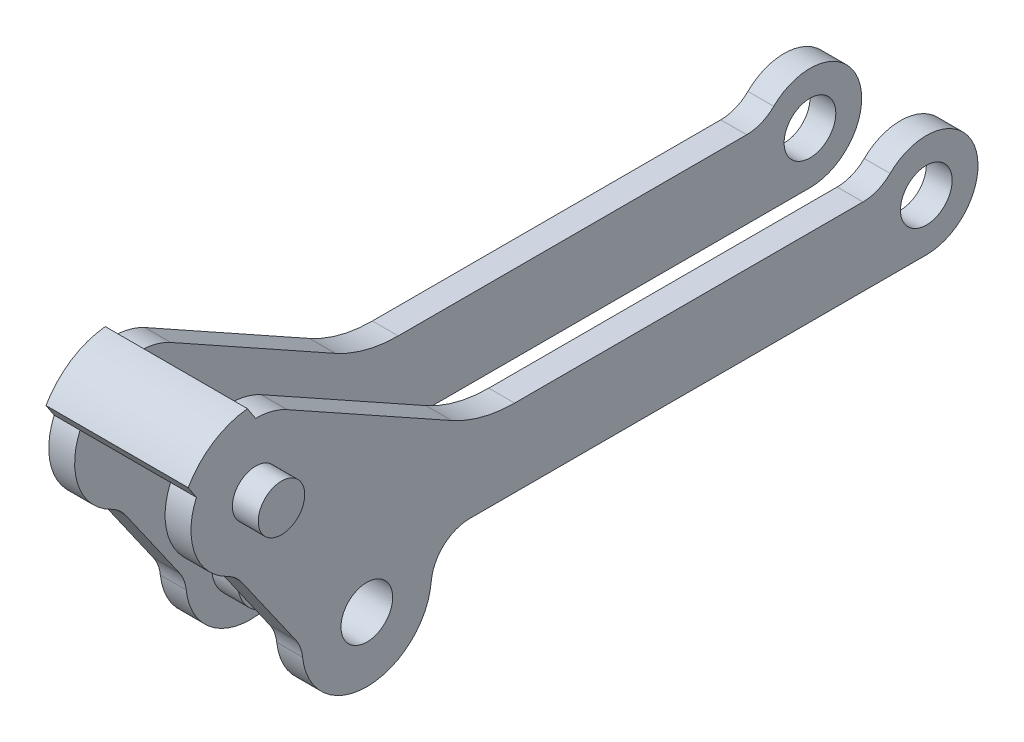
from build123d import *

# Parameters (mm, degrees)
EXTRUDE_1_DEPTH          = 2
SKETCH_1_4_R             = 3
EXTRUDE_2_DEPTH          = 2
CUT_EXTRUDE_1_DEPTH      = 51.040969284
CUT_EXTRUDE_1_DEPTH_BACK = 51.040969284
SKETCH_1_3_R             = 2
FILLET_1_R               = 3
EXTRUDE_START            = -2
SKETCH_2_R               = 2
EXTRUDE_3_DEPTH          = 2
SKETCH_2_3_R             = 1.8
EXTRUDE_4_DEPTH          = 2
EXTRUDE_6_DEPTH          = 2
EXTRUDE_START_2          = -5.5
EXTRUDE_5_DEPTH          = 5.5
FILLET_3_R               = 10


with BuildPart() as part:
    # 草图1 → 凸台-拉伸1 (new body)
    with BuildSketch(Plane(origin=(0, 0, 0), x_dir=(0, 0, -1), z_dir=(1, 0, 0))):
        with BuildLine():
            Line((40.737143614, 0), (0, 0))
            Line((0, 0), (2.48051592, -3.542543867))
            ThreePointArc((2.48051592, -3.542543867), (4.165783411, -4.487079684), (5.367176995, -6))
            Line((5.367176995, -6), (44.201245229, -6))
            ThreePointArc((44.201245229, -6), (40.737143614, -4), (40.737143614, 0))
        make_face()
        with BuildLine():
            Line((2.48051592, -3.542543867), (0, 0))
            Line((0, 0), (-2.681672007, 3.829824531))
            ThreePointArc((-2.681672007, 3.829824531), (-4.811127311, -0.102785303), (-9.234888361, -0.758786959))
            Line((-9.234888361, -0.758786959), (-4.072700434, -8.131155358))
            ThreePointArc((-4.072700434, -8.131155358), (-1.94324513, -4.198545524), (2.48051592, -3.542543867))
        make_face()
        with BuildLine():
            ThreePointArc((48.201245229, -2), (45.23652141, 1.863703305), (40.737143614, 0))
            Line((40.737143614, 0), (44.201245229, 0))
            ThreePointArc((44.201245229, 0), (45.615458792, -0.585786438), (46.201245229, -2))
            ThreePointArc((46.201245229, -2), (45.615458792, -3.414213562), (44.201245229, -4))
            Line((44.201245229, -4), (44.201245229, -6))
            ThreePointArc((44.201245229, -6), (47.029672354, -4.828427125), (48.201245229, -2))
        make_face()
        with BuildLine():
            Line((44.201245229, 0), (40.737143614, 0))
            ThreePointArc((40.737143614, 0), (40.737143614, -4), (44.201245229, -6))
            Line((44.201245229, -6), (44.201245229, -4))
            ThreePointArc((44.201245229, -4), (42.201245229, -2), (44.201245229, 0))
        make_face()
        with BuildLine():
            ThreePointArc((5.367176995, -6), (4.165783411, -4.487079684), (2.48051592, -3.542543867))
            Line((2.48051592, -3.542543867), (4.201245229, -6))
            Line((4.201245229, -6), (5.367176995, -6))
        make_face()
        with BuildLine():
            Line((4.201245229, -6), (2.48051592, -3.542543867))
            ThreePointArc((2.48051592, -3.542543867), (-1.94324513, -4.198545524), (-4.072700434, -8.131155358))
            Line((-4.072700434, -8.131155358), (-2.351971125, -10.588611491))
            Line((-2.351971125, -10.588611491), (-1.532819081, -10.015035054))
            ThreePointArc((-1.532819081, -10.015035054), (-0.796092257, -5.836849613), (3.382093185, -6.573576436))
            Line((3.382093185, -6.573576436), (4.201245229, -6))
        make_face()
        with BuildLine():
            ThreePointArc((-9.234888361, -0.758786959), (-4.811127311, -0.102785303), (-2.681672007, 3.829824531))
            Line((-2.681672007, 3.829824531), (-4.402401316, 6.287280664))
            Line((-4.402401316, 6.287280664), (-6.040705405, 5.140127792))
            ThreePointArc((-6.040705405, 5.140127792), (-5.771575592, 4.594386518), (-5.679009493, 3.992974919))
            ThreePointArc((-5.679009493, 3.992974919), (-7.077597894, 2.085541017), (-9.317313582, 2.845822046))
            Line((-9.317313582, 2.845822046), (-10.95561767, 1.698669174))
            Line((-10.95561767, 1.698669174), (-9.234888361, -0.758786959))
        make_face()
        with BuildLine():
            Line((-4.402401316, 6.287280664), (-2.681672007, 3.829824531))
            ThreePointArc((-2.681672007, 3.829824531), (-2.679675166, 3.911388863), (-2.679009493, 3.992974919))
            ThreePointArc((-2.679009493, 3.992974919), (-10.613341245, 8.041394014), (-9.234888361, -0.758786959))
            Line((-9.234888361, -0.758786959), (-10.95561767, 1.698669174))
            Line((-10.95561767, 1.698669174), (-9.317313582, 2.845822046))
            ThreePointArc((-9.317313582, 2.845822046), (-8.826162366, 5.631279008), (-6.040705405, 5.140127792))
            Line((-6.040705405, 5.140127792), (-4.402401316, 6.287280664))
        make_face()
        with BuildLine():
            ThreePointArc((46.201245229, -2), (45.615458792, -0.585786438), (44.201245229, 0))
            Line((44.201245229, 0), (44.201245229, -4))
            ThreePointArc((44.201245229, -4), (45.615458792, -3.414213562), (46.201245229, -2))
        make_face()
        with BuildLine():
            Line((44.201245229, -4), (44.201245229, 0))
            ThreePointArc((44.201245229, 0), (42.201245229, -2), (44.201245229, -4))
        make_face()
        with BuildLine():
            Line((5.367176995, -6), (4.201245229, -6))
            Line((4.201245229, -6), (3.382093185, -6.573576436))
            ThreePointArc((3.382093185, -6.573576436), (3.785787904, -7.392188347), (3.924637052, -8.294305745))
            ThreePointArc((3.924637052, -8.294305745), (1.826754451, -11.155456598), (-1.532819081, -10.015035054))
            Line((-1.532819081, -10.015035054), (-2.351971125, -10.588611491))
            Line((-2.351971125, -10.588611491), (-4.072700434, -8.131155358))
            ThreePointArc((-4.072700434, -8.131155358), (0.843050996, -13.293640073), (5.924637052, -8.294305745))
            ThreePointArc((5.924637052, -8.294305745), (5.783273678, -7.113776143), (5.367176995, -6))
        make_face()
        with BuildLine():
            ThreePointArc((3.924637052, -8.294305745), (3.785787904, -7.392188347), (3.382093185, -6.573576436))
            Line((3.382093185, -6.573576436), (2.562941141, -7.147152873))
            ThreePointArc((2.562941141, -7.147152873), (2.832070954, -7.692894146), (2.924637052, -8.294305745))
            ThreePointArc((2.924637052, -8.294305745), (1.526048651, -10.201739647), (-0.713667036, -9.441458618))
            Line((-0.713667036, -9.441458618), (-1.532819081, -10.015035054))
            ThreePointArc((-1.532819081, -10.015035054), (1.826754451, -11.155456598), (3.924637052, -8.294305745))
        make_face()
        with BuildLine():
            Line((2.562941141, -7.147152873), (3.382093185, -6.573576436))
            ThreePointArc((3.382093185, -6.573576436), (-0.796092257, -5.836849613), (-1.532819081, -10.015035054))
            Line((-1.532819081, -10.015035054), (-0.713667036, -9.441458618))
            ThreePointArc((-0.713667036, -9.441458618), (-0.222515821, -6.656001657), (2.562941141, -7.147152873))
        make_face()
        with BuildLine():
            ThreePointArc((-5.679009493, 3.992974919), (-5.771575592, 4.594386518), (-6.040705405, 5.140127792))
            Line((-6.040705405, 5.140127792), (-9.317313582, 2.845822046))
            ThreePointArc((-9.317313582, 2.845822046), (-7.077597894, 2.085541017), (-5.679009493, 3.992974919))
        make_face()
        with BuildLine():
            Line((-9.317313582, 2.845822046), (-6.040705405, 5.140127792))
            ThreePointArc((-6.040705405, 5.140127792), (-8.826162366, 5.631279008), (-9.317313582, 2.845822046))
        make_face()
        with BuildLine():
            ThreePointArc((2.924637052, -8.294305745), (2.832070954, -7.692894146), (2.562941141, -7.147152873))
            Line((2.562941141, -7.147152873), (-0.713667036, -9.441458618))
            ThreePointArc((-0.713667036, -9.441458618), (1.526048651, -10.201739647), (2.924637052, -8.294305745))
        make_face()
        with BuildLine():
            Line((-0.713667036, -9.441458618), (2.562941141, -7.147152873))
            ThreePointArc((2.562941141, -7.147152873), (-0.222515821, -6.656001657), (-0.713667036, -9.441458618))
        make_face()
    extrude(amount=EXTRUDE_1_DEPTH)

    # 草图1<4> → 凸台-拉伸2 (add)
    with BuildSketch(Plane(origin=(0, 0, 0), x_dir=(0, 0, -1), z_dir=(1, 0, 0))):
        with Locations((0.924637052, -8.294305745)):
            Circle(SKETCH_1_4_R)
    extrude(amount=-EXTRUDE_2_DEPTH)

    # 草图1<3> → 切除-拉伸1 (cut, two sides: drawn at the far end of the back side and taken through both)
    with BuildSketch(Plane(origin=(0, 0, 0), x_dir=(0, 0, -1), z_dir=(1, 0, 0)).offset(-CUT_EXTRUDE_1_DEPTH_BACK)):
        with Locations((-7.679009493, 3.992974919)):
            Circle(SKETCH_1_3_R)
        with Locations((44.201245229, -2)):
            Circle(SKETCH_1_3_R)
        with Locations((0.924637052, -8.294305745)):
            Circle(SKETCH_1_3_R)
    extrude(amount=CUT_EXTRUDE_1_DEPTH + CUT_EXTRUDE_1_DEPTH_BACK, mode=Mode.SUBTRACT)

    # 圆角1
    fillet_1_edges = [part.edges().sort_by_distance(p)[0] for p in [
        (1, -6, -5.367176995),
        (1, 0, 0),
        (1, 0, -40.737143614),
        (1, -0.758786959, 9.234888361),
        (1, -8.131155358, 4.072700434),
    ]]
    fillet(fillet_1_edges, radius=FILLET_1_R)

    # 草图2 → 凸台-拉伸3 (add)
    with BuildSketch(Plane(origin=(2, 0, 0), x_dir=(0, 0, -1), z_dir=(1, 0, 0)).offset(EXTRUDE_START)):
        with Locations((-7.679009493, 3.992974919)):
            Circle(SKETCH_2_R)
    extrude(amount=EXTRUDE_3_DEPTH)

    # 草图2<3> → 凸台-拉伸4 (add)
    with BuildSketch(Plane(origin=(2, 0, 0), x_dir=(0, 0, -1), z_dir=(1, 0, 0))):
        with Locations((-7.679009493, 3.992974919)):
            Circle(SKETCH_2_3_R)
    extrude(amount=EXTRUDE_4_DEPTH)

    # 草图4 → 凸台-拉伸6 (add)
    with BuildSketch(Plane(origin=(2, 0, 0), x_dir=(0, 0, -1), z_dir=(1, 0, 0))):
        Polygon((-5.244772745, 8.360410259), (9.755227255, 0), (-5.244772745, 0), align=None)
    extrude(amount=-EXTRUDE_6_DEPTH)

    # 草图3 → 凸台-拉伸5 (add)
    with BuildSketch(Plane(origin=(2, 0, 0), x_dir=(0, 0, -1), z_dir=(1, 0, 0)).offset(EXTRUDE_START_2)):
        with BuildLine():
            Line((-12.894335644, 6.959517206), (-12.261585188, 5.992974919))
            ThreePointArc((-12.261585188, 5.992974919), (-10.417622281, 8.176275052), (-7.679009493, 8.992974919))
            Line((-7.679009493, 8.992974919), (-8.311759949, 9.959517206))
            ThreePointArc((-8.311759949, 9.959517206), (-10.965344838, 9.012935078), (-12.894335644, 6.959517206))
        make_face()
    extrude(amount=EXTRUDE_5_DEPTH)

    # 圆角3
    fillet_3_edges = [part.edges().sort_by_distance(p)[0] for p in [
        (1, 0, -9.755227255),
    ]]
    fillet(fillet_3_edges, radius=FILLET_3_R)

    # 镜向1: part across plane


with BuildPart() as part_1:
    add(part.part)
    add(part.part.mirror(Plane.ZY.offset(3.5)))


solid = part_1.part
